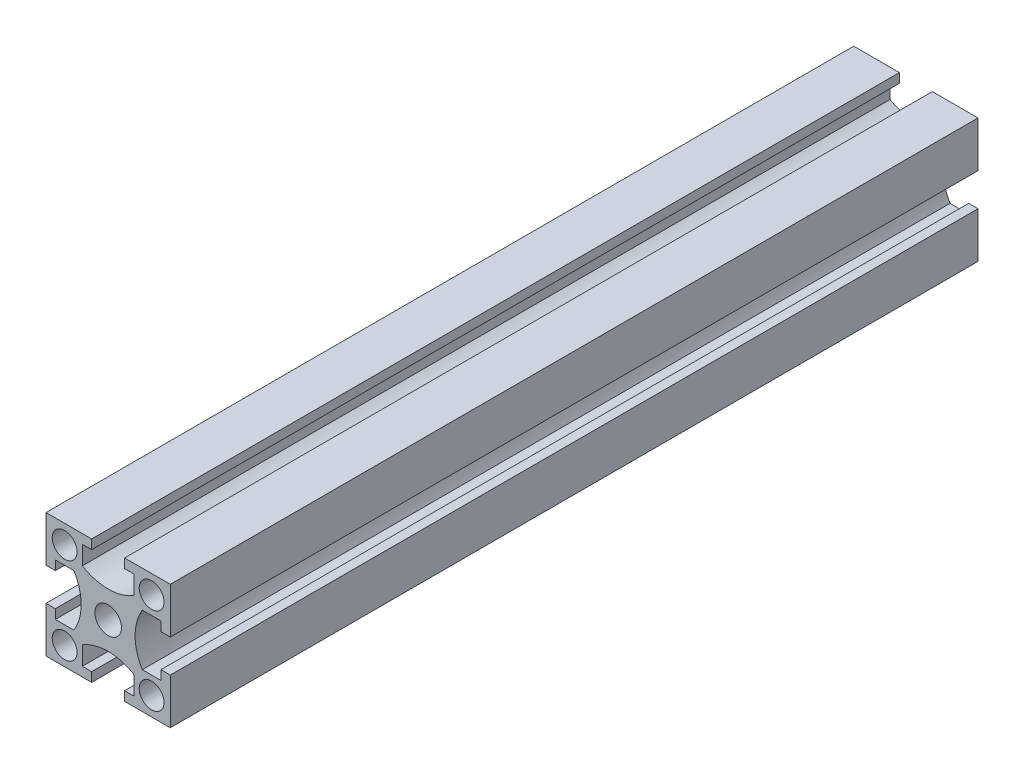
from build123d import *

# Parameters (mm, degrees)
SKETCH_1_W          = 20
SKETCH_1_H          = 20
EXTRUDE_1_DEPTH     = 130
SKETCH_2_R          = 2.15
SKETCH_2_R_2        = 2
CUT_EXTRUDE_1_DEPTH = 300


with BuildPart() as part:
    # 스케치1 → 보스-돌출1 (new body)
    with BuildSketch(Plane.XY):
        Rectangle(SKETCH_1_W, SKETCH_1_H)
    extrude(amount=EXTRUDE_1_DEPTH)

    # 스케치2 → 컷-돌출1 (cut)
    with BuildSketch(Plane.XY.offset(130)):
        Circle(SKETCH_2_R)
        with Locations((-7, 7)):
            Circle(SKETCH_2_R_2)
        with Locations((7, 7)):
            Circle(SKETCH_2_R_2)
        with Locations((7, -7)):
            Circle(SKETCH_2_R_2)
        with Locations((-7, -7)):
            Circle(SKETCH_2_R_2)
        with BuildLine():
            Line((-2.65, 10), (-2.65, 8.5))
            Line((-2.65, 8.5), (-4.15, 8.5))
            Line((-4.15, 8.5), (-4.15, 5.5))
            ThreePointArc((-4.15, 5.5), (0, 4.339407869), (4.15, 5.5))
            Line((4.15, 5.5), (4.15, 8.5))
            Line((4.15, 8.5), (2.65, 8.5))
            Line((2.65, 8.5), (2.65, 10))
            Line((2.65, 10), (-2.65, 10))
        make_face()
        with BuildLine():
            Line((10, 2.65), (8.5, 2.65))
            Line((8.5, 2.65), (8.5, 4.15))
            Line((8.5, 4.15), (5.5, 4.15))
            ThreePointArc((5.5, 4.15), (4.339407869, 0), (5.5, -4.15))
            Line((5.5, -4.15), (8.5, -4.15))
            Line((8.5, -4.15), (8.5, -2.65))
            Line((8.5, -2.65), (10, -2.65))
            Line((10, -2.65), (10, 2.65))
        make_face()
        with BuildLine():
            Line((2.65, -10), (2.65, -8.5))
            Line((2.65, -8.5), (4.15, -8.5))
            Line((4.15, -8.5), (4.15, -5.5))
            ThreePointArc((4.15, -5.5), (0, -4.339407869), (-4.15, -5.5))
            Line((-4.15, -5.5), (-4.15, -8.5))
            Line((-4.15, -8.5), (-2.65, -8.5))
            Line((-2.65, -8.5), (-2.65, -10))
            Line((-2.65, -10), (2.65, -10))
        make_face()
        with BuildLine():
            Line((-10, -2.65), (-8.5, -2.65))
            Line((-8.5, -2.65), (-8.5, -4.15))
            Line((-8.5, -4.15), (-5.5, -4.15))
            ThreePointArc((-5.5, -4.15), (-4.339407869, 0), (-5.5, 4.15))
            Line((-5.5, 4.15), (-8.5, 4.15))
            Line((-8.5, 4.15), (-8.5, 2.65))
            Line((-8.5, 2.65), (-10, 2.65))
            Line((-10, 2.65), (-10, -2.65))
        make_face()
    extrude(amount=-CUT_EXTRUDE_1_DEPTH, mode=Mode.SUBTRACT)


solid = part.part
